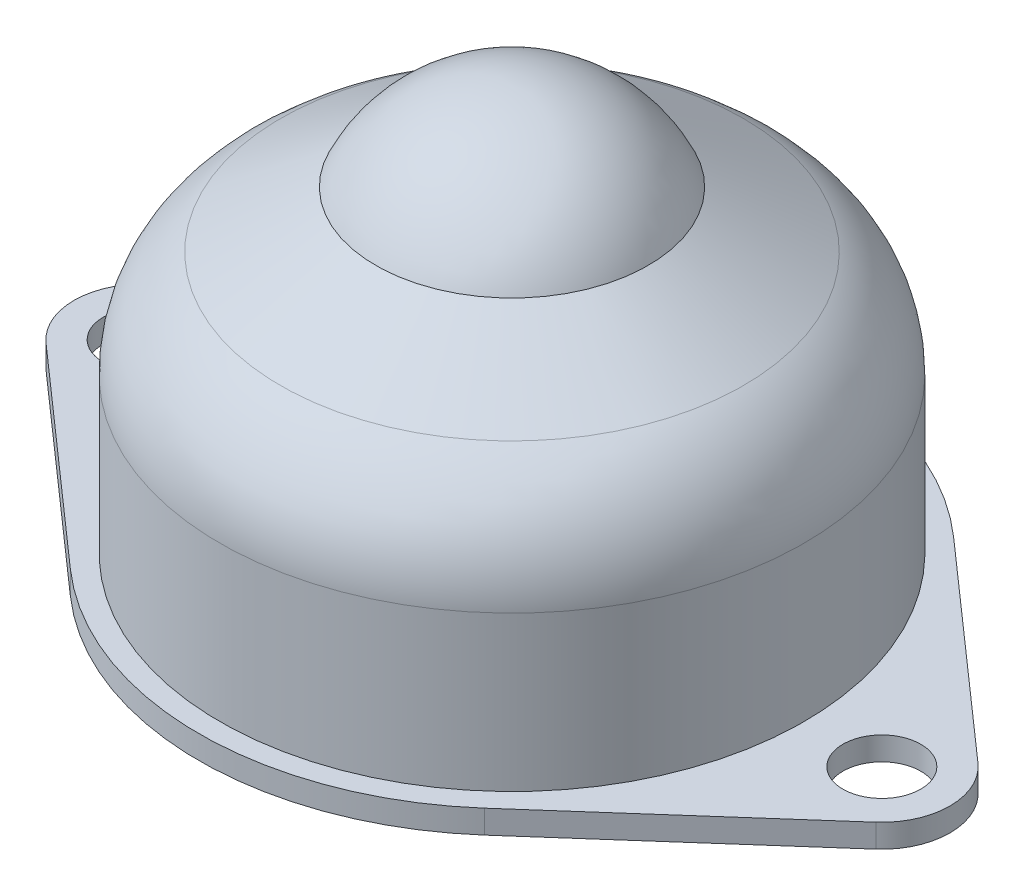
from build123d import *

# Parameters (mm, degrees)
SKETCH1_R           = 2
BOSS_EXTRUDE1_DEPTH = 1.2


with BuildPart() as part:
    # Sketch1 → Boss-Extrude1 (new body)
    with BuildSketch(Plane(origin=(0, 0, 0), x_dir=(1, 0, 0), z_dir=(0, 1, 0))):
        with BuildLine():
            ThreePointArc((-10.639111842, -12.050515516), (0, -16.075), (10.639111842, -12.050515516))
            Line((10.639111842, -12.050515516), (21.316447368, -2.623751434))
            ThreePointArc((21.316447368, -2.623751434), (22.5, 0), (21.316447368, 2.623751434))
            Line((21.316447368, 2.623751434), (10.639111842, 12.050515516))
            ThreePointArc((10.639111842, 12.050515516), (0, 16.075), (-10.639111842, 12.050515516))
            Line((-10.639111842, 12.050515516), (-21.316447368, 2.623751434))
            ThreePointArc((-21.316447368, 2.623751434), (-22.5, 0), (-21.316447368, -2.623751434))
            Line((-21.316447368, -2.623751434), (-10.639111842, -12.050515516))
        make_face()
        with Locations(Location((-19, 0, 0), (0, 0, 270))):
            Circle(SKETCH1_R, mode=Mode.SUBTRACT)
        with Locations(Location((19, 0, 0), (0, 0, 270))):
            Circle(SKETCH1_R, mode=Mode.SUBTRACT)
    extrude(amount=BOSS_EXTRUDE1_DEPTH)

    # Sketch3 → Revolve1 (revolve)
    with BuildSketch(Plane.XY, mode=Mode.PRIVATE) as revolve1_sk:
        with BuildLine():
            Line((-15, 1.2), (-15, 9.1375))
            ThreePointArc((-15, 9.1375), (-14.168033936, 12.279760569), (-11.890141265, 14.598634001))
            Line((-11.890141265, 14.598634001), (-7, 17.5))
            ThreePointArc((-7, 17.5), (-4.160829244, 20.777956602), (0, 22))
            Line((0, 22), (0, 1.2))
            Line((0, 1.2), (-15, 1.2))
        make_face()
    revolve(revolve1_sk.sketch.rotate(Axis((0, 1.2, 0), (0, 1, 0)), 270), axis=Axis((0, 1.2, 0), (0, 1, 0)))


solid = part.part
